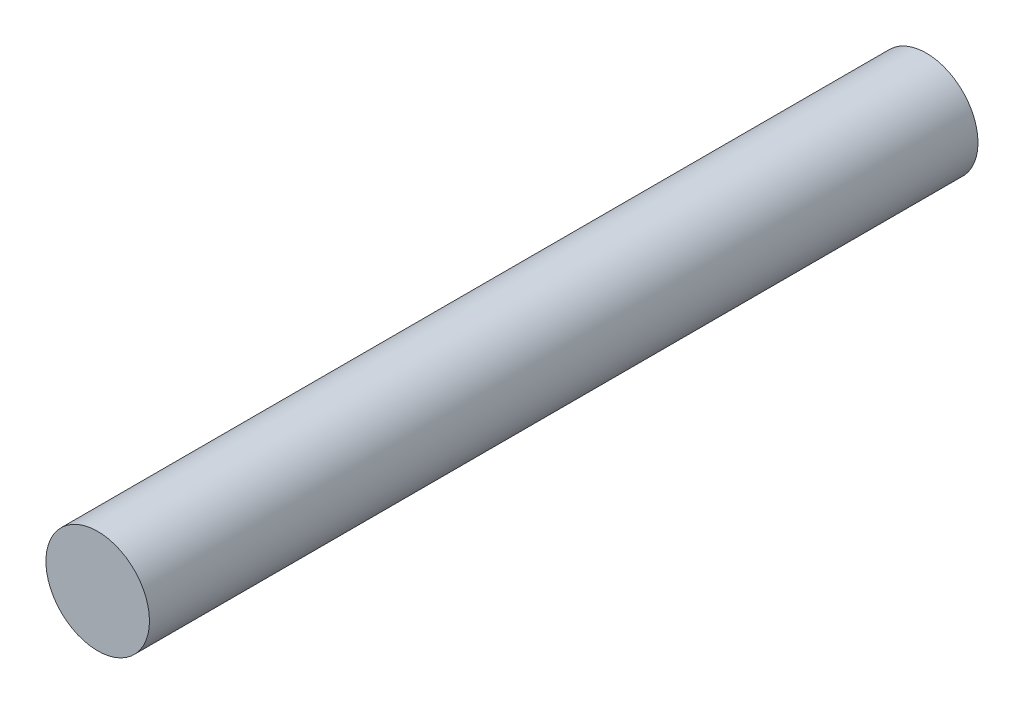
from build123d import *

# Parameters (mm, degrees)
SKETCH3_R           = 0.85
BOSS_EXTRUDE1_DEPTH = 13.6


with BuildPart() as part:
    # Sketch3 → Boss-Extrude1 (new body)
    with BuildSketch(Plane.XY):
        Circle(SKETCH3_R)
    extrude(amount=BOSS_EXTRUDE1_DEPTH)


solid = part.part
